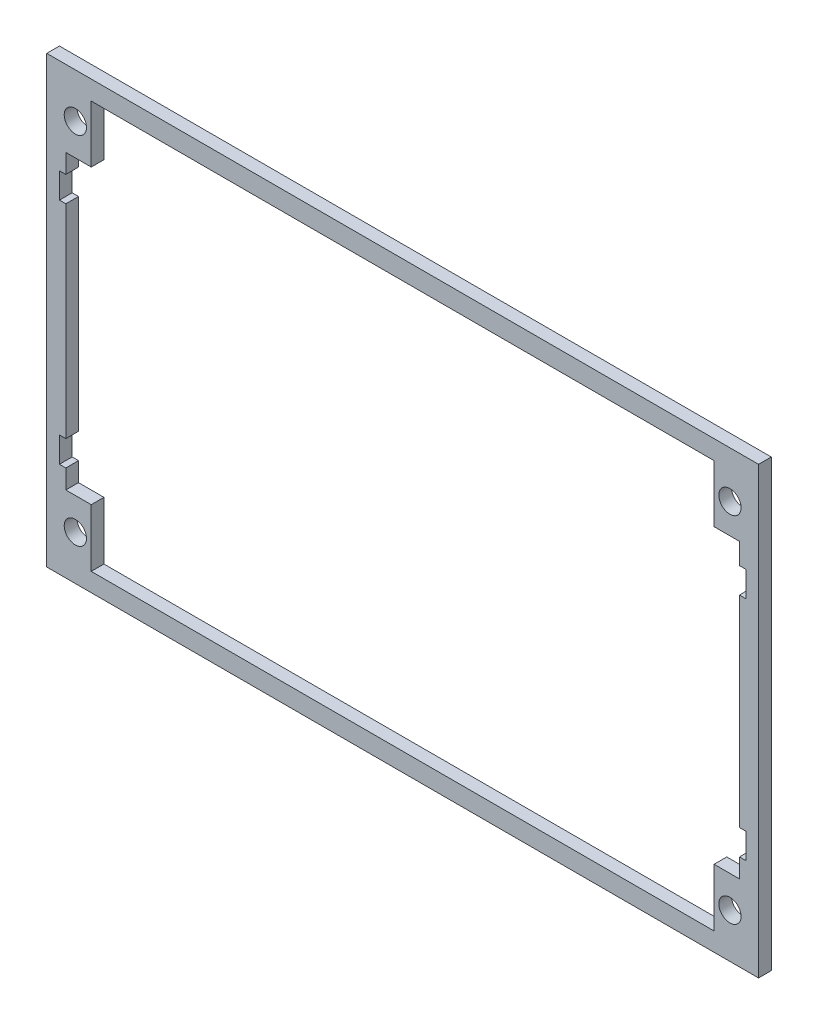
from build123d import *

# Parameters (mm, degrees)
SKETCH1_W           = 112
SKETCH1_H           = 70
BOSS_EXTRUDE1_DEPTH = 2
SKETCH2_W           = 98
SKETCH2_H           = 64.091260174
CUT_EXTRUDE1_DEPTH  = 133.090877808
SKETCH3_W           = 4
SKETCH3_H           = 46
CUT_EXTRUDE2_DEPTH  = 133.090877808
SKETCH4_R           = 1.75
SKETCH4_W           = 1
SKETCH4_H           = 4
CUT_EXTRUDE3_DEPTH  = 133.090877808


with BuildPart() as part:
    # Sketch1 → Boss-Extrude1 (new body)
    with BuildSketch(Plane.XY):
        with Locations((56, 35)):
            Rectangle(SKETCH1_W, SKETCH1_H)
    extrude(amount=BOSS_EXTRUDE1_DEPTH)

    # Sketch2 → Cut-Extrude1 (cut, through all)
    with BuildSketch(Plane.XY.offset(2)):
        with Locations((56, 34.954369913)):
            Rectangle(SKETCH2_W, SKETCH2_H)
    extrude(amount=-CUT_EXTRUDE1_DEPTH, mode=Mode.SUBTRACT)

    # Sketch3 → Cut-Extrude2 (cut, through all)
    with BuildSketch(Plane.XY.offset(2)):
        with Locations((5, 35)):
            Rectangle(SKETCH3_W, SKETCH3_H)
        with Locations((107, 35)):
            Rectangle(SKETCH3_W, SKETCH3_H)
    extrude(amount=-CUT_EXTRUDE2_DEPTH, mode=Mode.SUBTRACT)

    # Sketch4 → Cut-Extrude3 (cut, through all)
    with BuildSketch(Plane.XY.offset(2)):
        with Locations((4.5, 63)):
            Circle(SKETCH4_R)
        with Locations((4.5, 7)):
            Circle(SKETCH4_R)
        with Locations((107.5, 7)):
            Circle(SKETCH4_R)
        with Locations((107.5, 62.689831266)):
            Circle(SKETCH4_R)
        with Locations((2.5, 53)):
            Rectangle(SKETCH4_W, SKETCH4_H)
        with Locations((2.5, 17)):
            Rectangle(SKETCH4_W, SKETCH4_H)
        with Locations((109.5, 52.689831266)):
            Rectangle(SKETCH4_W, SKETCH4_H)
        with Locations((109.5, 17)):
            Rectangle(SKETCH4_W, SKETCH4_H)
    extrude(amount=-CUT_EXTRUDE3_DEPTH, mode=Mode.SUBTRACT)


solid = part.part
